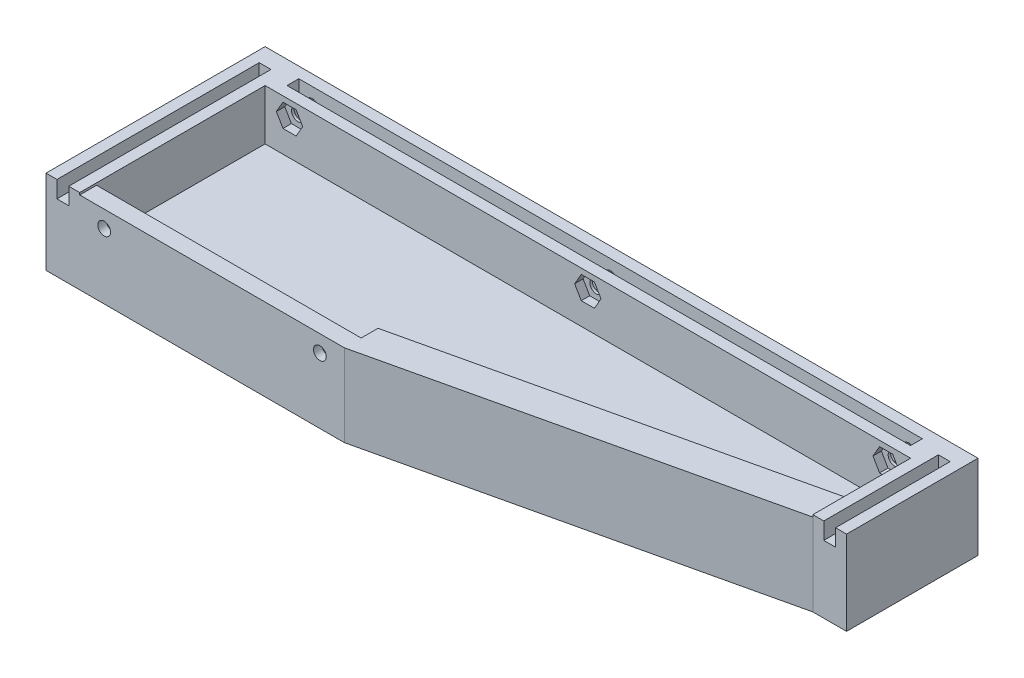
from build123d import *

# Parameters (mm, degrees)
SKETCH1_W           = 25
SKETCH1_H           = 211.5
BOSS_EXTRUDE1_DEPTH = 10
SKETCH2_W           = 10
SKETCH2_H           = 15
SKETCH2_H_2         = 10
SKETCH2_W_2         = 191.5
BOSS_EXTRUDE2_DEPTH = 45
SKETCH3_W           = 185
SKETCH3_H           = 3.5
CUT_EXTRUDE1_DEPTH  = 10
SKETCH4_R           = 1.9
CUT_EXTRUDE2_DEPTH  = 220.959655392
SKETCH5_R           = 3.35
CUT_EXTRUDE3_DEPTH  = 2.5
CUT_EXTRUDE4_DEPTH  = 2.5
LPATTERN1_COUNT     = 3
LPATTERN1_PITCH     = 88.5
CUT_EXTRUDE5_REACH  = 224.671
BOSS_EXTRUDE4_REACH = 224.671
CUT_EXTRUDE6_REACH  = 224.671
SKETCH11_W          = 78.5
SKETCH11_H          = 0.625
SKETCH11_W_2        = 113
SKETCH12_W          = 3.5
SKETCH12_H          = 34
CUT_EXTRUDE8_DEPTH  = 5
CUT_EXTRUDE9_DEPTH  = 5
SKETCH14_W          = 78.5
SKETCH14_H          = 5
CUT_EXTRUDE10_DEPTH = 14.375
CUT_EXTRUDE11_REACH = 224.671
SKETCH15_R          = 1.9
CUT_EXTRUDE12_DEPTH = 2.5
LPATTERN2_COUNT     = 2
LPATTERN2_PITCH     = 64


with BuildPart() as part:
    # Sketch1 → Boss-Extrude1 (new body)
    with BuildSketch(Plane(origin=(0, 0, 0), x_dir=(0, 1, 0), z_dir=(0, 0, 1))):
        with Locations((12.5, 105.75)):
            Rectangle(SKETCH1_W, SKETCH1_H)
    boss_extrude1 = extrude(amount=BOSS_EXTRUDE1_DEPTH)

    # Sketch2 → Boss-Extrude2 (add)
    with BuildSketch(Plane.XY.offset(10)):
        with Locations((-5, 17.5)):
            Rectangle(SKETCH2_W, SKETCH2_H)
        with Locations((-5, 5)):
            Rectangle(SKETCH2_W, SKETCH2_H_2)
        with Locations((-105.75, 5)):
            Rectangle(SKETCH2_W_2, SKETCH2_H_2)
        with Locations((-206.5, 5)):
            Rectangle(SKETCH2_W, SKETCH2_H_2)
        with Locations((-206.5, 17.5)):
            Rectangle(SKETCH2_W, SKETCH2_H)
    extrude(amount=BOSS_EXTRUDE2_DEPTH)

    # Mirror1: Boss-Extrude1 across plane
    add(boss_extrude1.mirror(Plane.XY.offset(32.5)))

    # Sketch3 → Cut-Extrude1 (cut)
    with BuildSketch(Plane(origin=(0, 25, 0), x_dir=(-1, 0, 0), z_dir=(0, 1, 0))):
        with Locations((105.75, 5)):
            Rectangle(SKETCH3_W, SKETCH3_H)
    extrude(amount=-CUT_EXTRUDE1_DEPTH, mode=Mode.SUBTRACT)

    # Sketch4 → Cut-Extrude2 (cut, through all)
    with BuildSketch(Plane(origin=(0, 0, 10), x_dir=(-1, 0, 0), z_dir=(0, 0, 1))):
        with Locations(Location((194.25, -20, 0), (0, 0, 180))):
            Circle(SKETCH4_R)
    cut_extrude2 = extrude(amount=-CUT_EXTRUDE2_DEPTH, mode=Mode.SUBTRACT)

    # Sketch5 → Cut-Extrude3 (cut)
    with BuildSketch(Plane(origin=(0, 0, 0), x_dir=(1, 0, 0), z_dir=(0, 0, -1))):
        with Locations(Location((-194.25, -20, 0), (0, 0, 180))):
            Circle(SKETCH5_R)
    cut_extrude3 = extrude(amount=-CUT_EXTRUDE3_DEPTH, mode=Mode.SUBTRACT)

    # Sketch6 → Cut-Extrude4 (cut)
    with BuildSketch(Plane.XY.offset(10)):
        Polygon((-192.297927406, 23.381088913), (-196.202072594, 23.381088913), (-198.154145188, 20), (-196.202072594, 16.618911087), (-192.297927406, 16.618911087), (-190.345854812, 20), align=None)
    cut_extrude4 = extrude(amount=-CUT_EXTRUDE4_DEPTH, mode=Mode.SUBTRACT)

    # LPattern1: Cut-Extrude2, Cut-Extrude3, Cut-Extrude4 ×3
    with Locations(*[(i * LPATTERN1_PITCH, 0, 0) for i in range(1, LPATTERN1_COUNT)]):
        add(cut_extrude2, mode=Mode.SUBTRACT)
        add(cut_extrude3, mode=Mode.SUBTRACT)
        add(cut_extrude4, mode=Mode.SUBTRACT)

    # Sketch9 → Cut-Extrude5 (cut, up to next)
    with BuildSketch(Plane.XZ, mode=Mode.PRIVATE) as cut_extrude5_sk1:
        Polygon((-10, 39), (0, 39), (0, 65), (-123, 65), align=None)
    cut_extrude5_tool1 = extrude(cut_extrude5_sk1.sketch, amount=-CUT_EXTRUDE5_REACH, mode=Mode.PRIVATE) & part.part
    add(cut_extrude5_tool1.solids().sort_by_distance((-41.250627, 0, 55.681704))[0], mode=Mode.SUBTRACT)

    # Sketch10 → Boss-Extrude4 (add, up to next)
    with BuildSketch(Plane(origin=(0, 25, 0), x_dir=(-1, 0, 0), z_dir=(0, 1, 0)), mode=Mode.PRIVATE) as boss_extrude4_sk1:
        Polygon((123, 65), (10, 39), (10, 29), (123, 55), align=None)
    boss_extrude4_tool1 = extrude(boss_extrude4_sk1.sketch, amount=-BOSS_EXTRUDE4_REACH, mode=Mode.PRIVATE) - part.part
    add(boss_extrude4_tool1.solids().sort_by_distance((-66.5, 25, 47))[0])

    # Sketch11 → Cut-Extrude6 (cut, up to next)
    with BuildSketch(Plane.XY.offset(65), mode=Mode.PRIVATE) as cut_extrude6_sk1:
        with Locations((-162.25, 24.6875)):
            Rectangle(SKETCH11_W, SKETCH11_H)
    cut_extrude6_tool1 = extrude(cut_extrude6_sk1.sketch, amount=-CUT_EXTRUDE6_REACH, mode=Mode.PRIVATE) & part.part
    # Sketch11 → Cut-Extrude6 (cut, up to next)
    with BuildSketch(Plane.XY.offset(65), mode=Mode.PRIVATE) as cut_extrude6_sk2:
        with Locations((-66.5, 24.6875)):
            Rectangle(SKETCH11_W_2, SKETCH11_H)
    cut_extrude6_tool2 = extrude(cut_extrude6_sk2.sketch, amount=-CUT_EXTRUDE6_REACH, mode=Mode.PRIVATE) & part.part
    add(cut_extrude6_tool1.solids().sort_by_distance((-162.25, 24.6875, 65))[0], mode=Mode.SUBTRACT)
    add(cut_extrude6_tool2.solids().sort_by_distance((-66.5, 24.6875, 65))[0], mode=Mode.SUBTRACT)

    # Sketch12 → Cut-Extrude8 (cut)
    with BuildSketch(Plane(origin=(0, 25, 0), x_dir=(-1, 0, 0), z_dir=(0, 1, 0))):
        with Locations((5, 22)):
            Rectangle(SKETCH12_W, SKETCH12_H)
    extrude(amount=-CUT_EXTRUDE8_DEPTH, mode=Mode.SUBTRACT)

    # Sketch13 → Cut-Extrude9 (cut)
    with BuildSketch(Plane(origin=(0, 25, 0), x_dir=(-1, 0, 0), z_dir=(0, 1, 0))):
        Polygon((204.75, 15), (204.75, 5), (208.25, 5), (208.25, 15), (208.25, 65), (204.75, 65), align=None)
    extrude(amount=-CUT_EXTRUDE9_DEPTH, mode=Mode.SUBTRACT)

    # Sketch14 → Cut-Extrude10 (cut)
    with BuildSketch(Plane(origin=(0, 24.375, 0), x_dir=(-1, 0, 0), z_dir=(0, 1, 0))):
        with Locations((162.25, 57.5)):
            Rectangle(SKETCH14_W, SKETCH14_H)
    extrude(amount=-CUT_EXTRUDE10_DEPTH, mode=Mode.SUBTRACT)

    # Sketch15 → Cut-Extrude11 (cut, up to next)
    with BuildSketch(Plane.XY.offset(65), mode=Mode.PRIVATE) as cut_extrude11_sk1:
        with Locations((-194.25, 19.375)):
            Circle(SKETCH15_R)
    cut_extrude11_tool1 = extrude(cut_extrude11_sk1.sketch, amount=-CUT_EXTRUDE11_REACH, mode=Mode.PRIVATE) & part.part
    cut_extrude11 = cut_extrude11_tool1.solids().sort_by_distance((-194.25, 19.375, 65))[0]
    add(cut_extrude11, mode=Mode.SUBTRACT)

    # Sketch16 → Cut-Extrude12 (cut)
    with BuildSketch(Plane(origin=(0, 0, 60), x_dir=(1, 0, 0), z_dir=(0, 0, -1))):
        Polygon((-192.297927406, -15.993911087), (-196.202072594, -15.993911087), (-198.154145188, -19.375), (-196.202072594, -22.756088913), (-192.297927406, -22.756088913), (-190.345854812, -19.375), align=None)
    cut_extrude12 = extrude(amount=-CUT_EXTRUDE12_DEPTH, mode=Mode.SUBTRACT)

    # LPattern2: Cut-Extrude11, Cut-Extrude12 ×2
    with Locations(*[(i * LPATTERN2_PITCH, 0, 0) for i in range(1, LPATTERN2_COUNT)]):
        add(cut_extrude11, mode=Mode.SUBTRACT)
        add(cut_extrude12, mode=Mode.SUBTRACT)


solid = part.part
